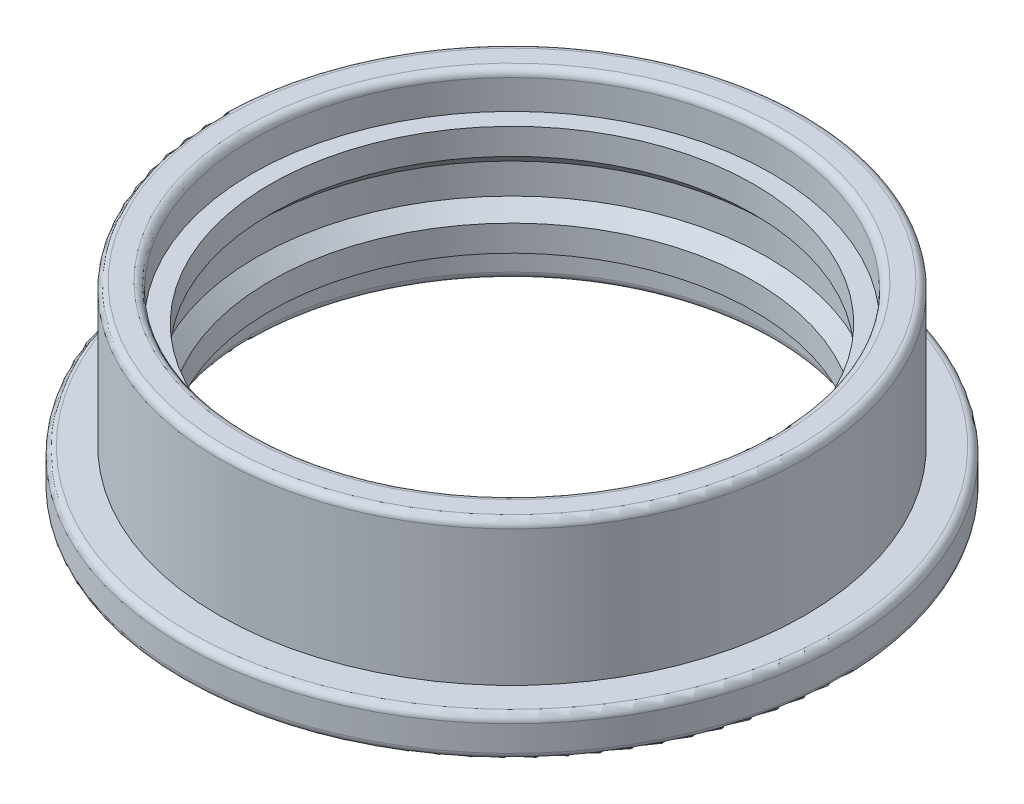
from build123d import *

# Parameters (mm, degrees)
IZIM1_R                     = 9
IZIM1_R_2                   = 6.6
Y_KSEKLIK_EKSTR_ZYON1_DEPTH = 5
KES_EKSTR_ZYON1_START       = -3.9
IZIM2_R                     = 9
IZIM2_R_2                   = 8
KES_EKSTR_ZYON1_DEPTH       = 3.9
IZIM3_R                     = 7.1
KES_EKSTR_ZYON2_DEPTH       = 1
L_O_ALTMA1_COUNT            = 2
L_O_ALTMA1_PITCH            = 4
RADYUS1_R                   = 0.2


with BuildPart() as part:
    # Çizim1 → Yükseklik-Ekstrüzyon1 (new body)
    with BuildSketch(Plane(origin=(0, 0, 0), x_dir=(1, 0, 0), z_dir=(0, 1, 0))):
        with Locations(Location((0, 0, 0), (0, 0, 270))):
            Circle(IZIM1_R)
        with Locations(Location((0, 0, 0), (0, 0, 270))):
            Circle(IZIM1_R_2, mode=Mode.SUBTRACT)
    extrude(amount=Y_KSEKLIK_EKSTR_ZYON1_DEPTH)

    # Çizim2 → Kes-Ekstrüzyon1 (cut)
    with BuildSketch(Plane(origin=(0, 5, 0), x_dir=(1, 0, 0), z_dir=(0, 1, 0)).offset(KES_EKSTR_ZYON1_START)):
        with Locations(Location((0, 0, 0), (0, 0, 270))):
            Circle(IZIM2_R)
        with Locations(Location((0, 0, 0), (0, 0, 270))):
            Circle(IZIM2_R_2, mode=Mode.SUBTRACT)
    extrude(amount=KES_EKSTR_ZYON1_DEPTH, mode=Mode.SUBTRACT)

    # Çizim3 → Kes-Ekstrüzyon2 (cut)
    with BuildSketch(Plane(origin=(0, 5, 0), x_dir=(1, 0, 0), z_dir=(0, 1, 0))):
        with Locations(Location((0, 0, 0), (0, 0, 270))):
            Circle(IZIM3_R)
    kes_ekstr_zyon2 = extrude(amount=-KES_EKSTR_ZYON2_DEPTH, mode=Mode.SUBTRACT)

    # LÇoğaltma1: Kes-Ekstrüzyon2 ×2
    with Locations(*[(0, -i * L_O_ALTMA1_PITCH, 0) for i in range(1, L_O_ALTMA1_COUNT)]):
        add(kes_ekstr_zyon2, mode=Mode.SUBTRACT)

    # Çizim5 → Kes-Döndür1 (revolve, cut)
    with BuildSketch(Plane.XY, mode=Mode.PRIVATE) as kes_d_nd_r1_sk:
        Polygon((-6.975, 2.914213562), (-6.975, 2.085786438), (-5.889213562, 1), (-5.889213562, 4), align=None)
    revolve(kes_d_nd_r1_sk.sketch.rotate(Axis((0, 0, 0), (0, 1, 0)), 270), axis=Axis((0, 0, 0), (0, 1, 0)), mode=Mode.SUBTRACT)

    # Radyus1
    radyus1_edges = [part.edges().sort_by_distance(p)[0] for p in [
        (0, 1.1, -9),
        (0, 5, -8),
        (0, 5, -7.1),
        (0, 0, -9),
        (0, 0, -7.1),
    ]]
    fillet(radyus1_edges, radius=RADYUS1_R)


solid = part.part
